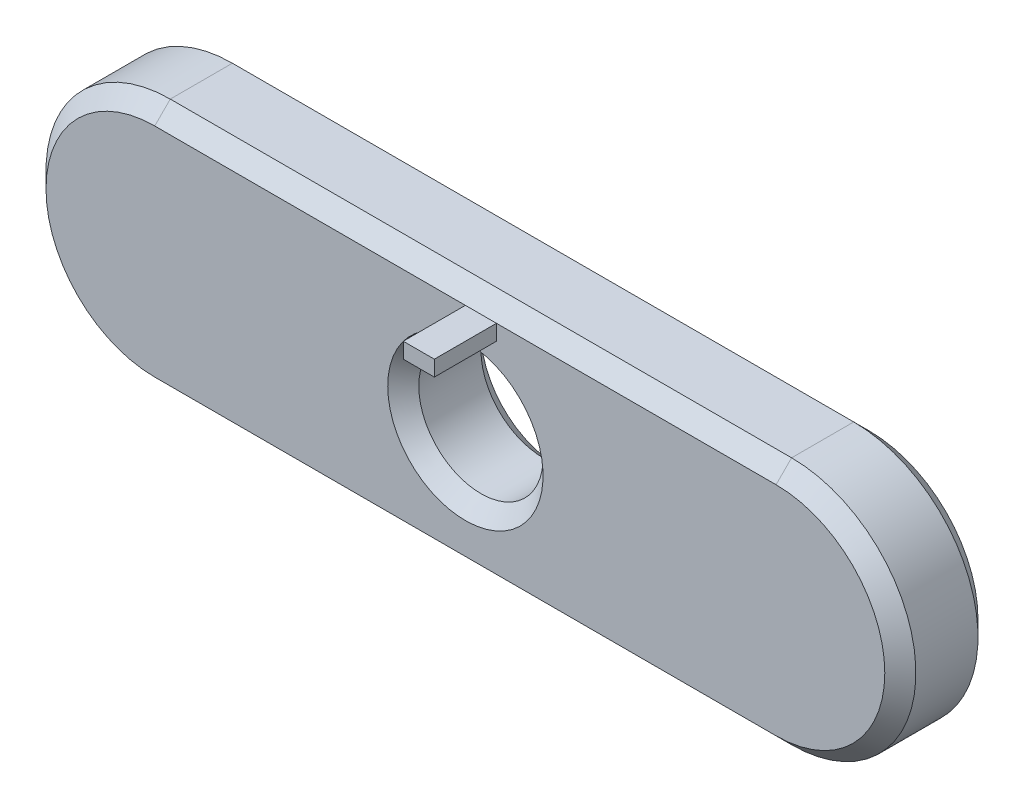
from build123d import *

# Parameters (mm, degrees)
BASE_EXTRUSION_DEPTH    = 3
ESQUISSE2_R             = 2
ENL_V_MAT_EXTRU_1_DEPTH = 3
CHANFREIN1_SIZE         = 0.5
ESQUISSE4_W             = 1
ESQUISSE4_H             = 0.5
BOSS_EXTRU_1_DEPTH      = 5


with BuildPart() as part:
    # Esquisse1 → Base-Extrusion (new body)
    with BuildSketch(Plane.XY):
        with BuildLine():
            Line((-10, 4), (10, 4))
            ThreePointArc((10, 4), (14, 0), (10, -4))
            Line((10, -4), (-10, -4))
            ThreePointArc((-10, -4), (-14, 0), (-10, 4))
        make_face()
    extrude(amount=BASE_EXTRUSION_DEPTH)

    # Esquisse2 → Enlèv. mat.-Extru.1 (cut)
    with BuildSketch(Plane.XY.offset(3)):
        with Locations(Location((0, 0, 0), (0, 0, 180))):
            Circle(ESQUISSE2_R)
    extrude(amount=-ENL_V_MAT_EXTRU_1_DEPTH, mode=Mode.SUBTRACT)

    # Chanfrein1
    chanfrein1_edges = [part.edges().sort_by_distance(p)[0] for p in [
        (0, -4, 0),
        (0, -4, 3),
        (14, 0, 0),
        (14, 0, 3),
        (-14, 0, 0),
        (-14, 0, 3),
        (0, 4, 0),
        (2, 0, 0),
        (0, 4, 3),
        (2, 0, 3),
    ]]
    chamfer(chanfrein1_edges, length=CHANFREIN1_SIZE)

    # Esquisse4 → Boss.-Extru.1 (add)
    with BuildSketch(Plane.XY):
        with Locations((0.5, 3.25)):
            Rectangle(ESQUISSE4_W, ESQUISSE4_H)
    extrude(amount=BOSS_EXTRU_1_DEPTH)


solid = part.part
